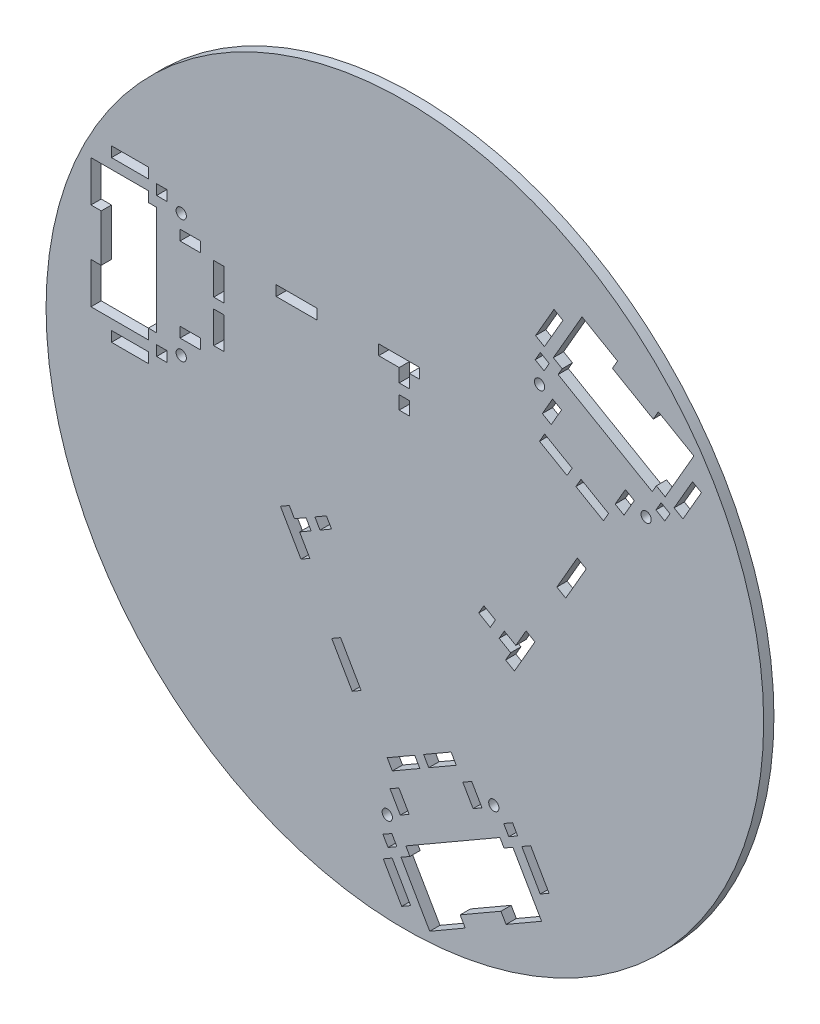
from build123d import *

# Parameters (mm, degrees)
ESQUISSE1_R             = 175
BOSS_EXTRU_1_DEPTH      = 5
ESQUISSE2_W             = 5
ESQUISSE2_H             = 6.5
ESQUISSE2_W_2           = 20
ESQUISSE2_H_2           = 5
ESQUISSE2_H_3           = 15.5
ESQUISSE2_W_3           = 10
ESQUISSE2_W_4           = 18
ESQUISSE2_H_4           = 20
ENL_V_MAT_EXTRU_1_DEPTH = 5
ENL_V_MAT_EXTRU_2_DEPTH = 5
ESQUISSE4_R             = 2.5
ENL_V_MAT_EXTRU_3_DEPTH = 5


with BuildPart() as part:
    # Esquisse1 → Boss.-Extru.1 (new body)
    with BuildSketch(Plane.XY):
        with Locations((148.080426897, -12.110171348)):
            Circle(ESQUISSE1_R)
    extrude(amount=BOSS_EXTRU_1_DEPTH)

    # Esquisse2 → Enlèv. mat.-Extru.1 (cut)
    with BuildSketch(Plane(origin=(0, 0, 0), x_dir=(-1, 0, 0), z_dir=(0, 0, -1))):
        Polygon((-155.311788567, 53.777441362), (-135.311788567, 53.777441362), (-135.311788567, 48.777441362), (-145.311788567, 48.777441362), (-145.311788567, 42.277441362), (-150.311788567, 42.277441362), (-150.311788567, 48.777441362), (-155.311788567, 48.777441362), align=None)
        with Locations((-147.811788567, 34.027441362)):
            Rectangle(ESQUISSE2_W, ESQUISSE2_H)
        with Locations((-95.311788567, 51.277441362)):
            Rectangle(ESQUISSE2_W_2, ESQUISSE2_H_2)
        with Locations((-57.36, 41.027441362)):
            Rectangle(ESQUISSE2_W, ESQUISSE2_H_3)
        with Locations((-57.36, 20.527441362)):
            Rectangle(ESQUISSE2_W, ESQUISSE2_H_3)
        with Locations((-43.43, 10.277441362)):
            Rectangle(ESQUISSE2_W_3, ESQUISSE2_H_2)
        with Locations((-29.5, -3.222558638)):
            Rectangle(ESQUISSE2_W, ESQUISSE2_H_2)
        with Locations((-14, -8.222558638)):
            Rectangle(ESQUISSE2_W_4, ESQUISSE2_H_2)
        with Locations((2.5, 9.277441362)):
            Rectangle(ESQUISSE2_W, ESQUISSE2_H_4)
        with Locations((2.5, 52.277441362)):
            Rectangle(ESQUISSE2_W, ESQUISSE2_H_4)
        with Locations((-14, 69.777441362)):
            Rectangle(ESQUISSE2_W_4, ESQUISSE2_H_2)
        with Locations((-29.5, 64.777441362)):
            Rectangle(ESQUISSE2_W, ESQUISSE2_H_2)
        with Locations((-43.43, 51.277441362)):
            Rectangle(ESQUISSE2_W_3, ESQUISSE2_H_2)
        Polygon((-87.404399659, -38.791434793), (-97.404399659, -56.111942869), (-101.734526678, -53.611942869), (-96.734526678, -44.951688831), (-102.363691803, -41.701688831), (-99.863691803, -37.371561812), (-94.234526678, -40.621561812), (-91.734526678, -36.291434793), align=None)
        Polygon((-104.193818822, -34.871561812), (-106.693818822, -39.201688831), (-112.322983946, -35.951688831), (-109.822983946, -31.621561812), align=None)
        Polygon((-112.404399659, -82.092704982), (-122.404399659, -99.413213058), (-126.734526678, -96.913213058), (-116.734526678, -79.592704982), align=None)
        Polygon((-139.460420962, -118.955108529), (-141.960420962, -123.285235548), (-155.38381472, -115.535235548), (-152.88381472, -111.205108529), align=None)
        Polygon((-157.213941739, -108.705108529), (-159.713941739, -113.035235548), (-173.137335498, -105.285235548), (-170.637335498, -100.955108529), align=None)
        Polygon((-176.352335498, -110.853778894), (-181.352335498, -119.514032932), (-185.682462517, -117.014032932), (-180.682462517, -108.353778894), align=None)
        Polygon((-196.258678449, -118.332576278), (-198.758678449, -122.662703297), (-203.088805468, -120.162703297), (-200.588805468, -115.832576278), align=None)
        Polygon((-205.088805468, -123.626804912), (-214.088805468, -139.215262181), (-218.418932487, -136.715262181), (-209.418932487, -121.126804912), align=None)
        Polygon((-212.258678449, -146.045389199), (-214.758678449, -150.375516218), (-197.438170373, -160.375516218), (-194.938170373, -156.045389199), align=None)
        Polygon((-175.019586086, -167.545389199), (-177.519586086, -171.875516218), (-160.199078011, -181.875516218), (-157.699078011, -177.545389199), align=None)
        Polygon((-141.868950992, -160.126804912), (-150.868950992, -175.715262181), (-146.538823973, -178.215262181), (-137.538823973, -162.626804912), align=None)
        Polygon((-139.868950992, -156.662703297), (-137.368950992, -152.332576278), (-141.699078011, -149.832576278), (-144.199078011, -154.162703297), align=None)
        Polygon((-145.845293943, -140.014032932), (-140.845293943, -131.353778894), (-145.175420962, -128.853778894), (-150.175420962, -137.514032932), align=None)
        Polygon((-201.525092463, -51.316520615), (-211.525092463, -33.996012539), (-207.194965444, -31.496012539), (-202.194965444, -40.156266577), (-196.56580032, -36.906266577), (-194.06580032, -41.236393596), (-199.694965444, -44.486393596), (-197.194965444, -48.816520615), align=None)
        Polygon((-189.735673301, -38.736393596), (-192.235673301, -34.406266577), (-186.606508176, -31.156266577), (-184.106508176, -35.486393596), align=None)
        Polygon((-226.525092463, -8.015250425), (-236.525092463, 9.30525765), (-232.194965444, 11.80525765), (-222.194965444, -5.515250425), align=None)
        Polygon((-244.920859728, 33.847153121), (-247.420859728, 38.17728014), (-233.997465969, 45.92728014), (-231.497465969, 41.597153121), align=None)
        Polygon((-227.16733895, 44.097153121), (-229.66733895, 48.42728014), (-216.243945192, 56.17728014), (-213.743945192, 51.847153121), align=None)
        Polygon((-219.458945192, 61.745823487), (-224.458945192, 70.406077524), (-220.128818173, 72.906077524), (-215.128818173, 64.245823487), align=None)
        Polygon((-215.982602241, 82.724620871), (-218.482602241, 87.05474789), (-214.152475222, 89.55474789), (-211.652475222, 85.224620871), align=None)
        Polygon((-216.152475222, 93.018849505), (-225.152475222, 108.607306773), (-220.822348203, 111.107306773), (-211.822348203, 95.518849505), align=None)
        Polygon((-231.982602241, 110.437433792), (-234.482602241, 114.767560811), (-251.803110316, 104.767560811), (-249.303110316, 100.437433792), align=None)
        Polygon((-269.221694603, 88.937433792), (-271.721694603, 93.267560811), (-289.042202679, 83.267560811), (-286.542202679, 78.937433792), align=None)
        Polygon((-279.372329698, 56.518849505), (-288.372329698, 72.107306773), (-292.702456717, 69.607306773), (-283.702456717, 54.018849505), align=None)
        Polygon((-277.372329698, 53.05474789), (-274.872329698, 48.724620871), (-270.542202679, 51.224620871), (-273.042202679, 55.55474789), align=None)
        Polygon((-259.965986747, 49.906077524), (-254.965986747, 41.245823487), (-250.635859728, 43.745823487), (-255.635859728, 52.406077524), align=None)
    extrude(amount=-ENL_V_MAT_EXTRU_1_DEPTH, mode=Mode.SUBTRACT)

    # Esquisse3 → Enlèv. mat.-Extru.2 (cut)
    with BuildSketch(Plane(origin=(0, 0, 0), x_dir=(-1, 0, 0), z_dir=(0, 0, -1))):
        Polygon((0, -0.722558638), (-23, -0.722558638), (-23, 4.277441362), (-27, 4.277441362), (-27, 57.277441362), (-23, 57.277441362), (-23, 62.277441362), (0, 62.277441362), align=None)
        Polygon((-212.258678449, -146.045389199), (-200.758678449, -126.126804912), (-196.42855143, -128.626804912), (-194.42855143, -125.162703297), (-148.52920503, -151.662703297), (-150.52920503, -155.126804912), (-146.199078011, -157.626804912), (-157.699078011, -177.545389199), align=None)
        Polygon((-231.982602241, 110.437433792), (-220.482602241, 90.518849505), (-224.81272926, 88.018849505), (-222.81272926, 84.55474789), (-268.71207566, 58.05474789), (-270.71207566, 61.518849505), (-275.042202679, 59.018849505), (-286.542202679, 78.937433792), align=None)
    extrude(amount=-ENL_V_MAT_EXTRU_2_DEPTH, mode=Mode.SUBTRACT)

    # Esquisse4 → Enlèv. mat.-Extru.3 (cut)
    with BuildSketch(Plane(origin=(0, 0, 0), x_dir=(-1, 0, 0), z_dir=(0, 0, -1))):
        with Locations((-39, 60.777441362)):
            Circle(ESQUISSE4_R)
        with Locations(Location((-39, 0.777441362, 0), (0, 0, 180))):
            Circle(ESQUISSE4_R)
        with Locations((-139.498116116, -143.020398452)):
            Circle(ESQUISSE4_R)
        with Locations(Location((-191.459640343, -113.020398452, 0), (0, 0, 180))):
            Circle(ESQUISSE4_R)
        with Locations((-265.743164573, 45.912443044)):
            Circle(ESQUISSE4_R)
        with Locations(Location((-213.781640346, 75.912443044, 0), (0, 0, 180))):
            Circle(ESQUISSE4_R)
    extrude(amount=-ENL_V_MAT_EXTRU_3_DEPTH, mode=Mode.SUBTRACT)


solid = part.part
